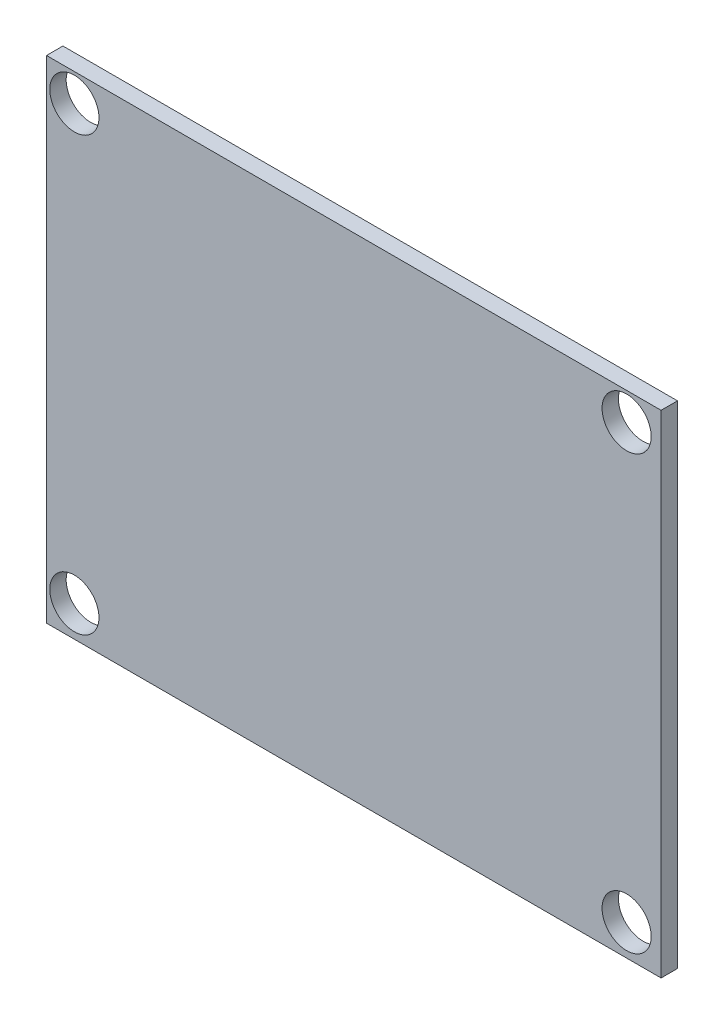
from build123d import *

# Parameters (mm, degrees)
ESQUISSE3_W             = 75
ESQUISSE3_H             = 60
BOSS_EXTRU_4_DEPTH      = 2
ESQUISSE9_R             = 3
ENL_V_MAT_EXTRU_1_DEPTH = 2


with BuildPart() as part:
    # Esquisse3 → Boss.-Extru.4 (new body)
    with BuildSketch(Plane.XY):
        Rectangle(ESQUISSE3_W, ESQUISSE3_H)
    extrude(amount=BOSS_EXTRU_4_DEPTH)

    # Esquisse9 → Enlèv. mat.-Extru.1 (cut)
    with BuildSketch(Plane.XY.offset(2)):
        with Locations((-34.10132307, 26.617640071)):
            Circle(ESQUISSE9_R)
        with Locations((33.292276259, 26.617640071)):
            Circle(ESQUISSE9_R)
        with Locations((33.292276259, -26.213116666)):
            Circle(ESQUISSE9_R)
        with Locations((-34.10132307, -26.213116666)):
            Circle(ESQUISSE9_R)
    extrude(amount=-ENL_V_MAT_EXTRU_1_DEPTH, mode=Mode.SUBTRACT)


solid = part.part
